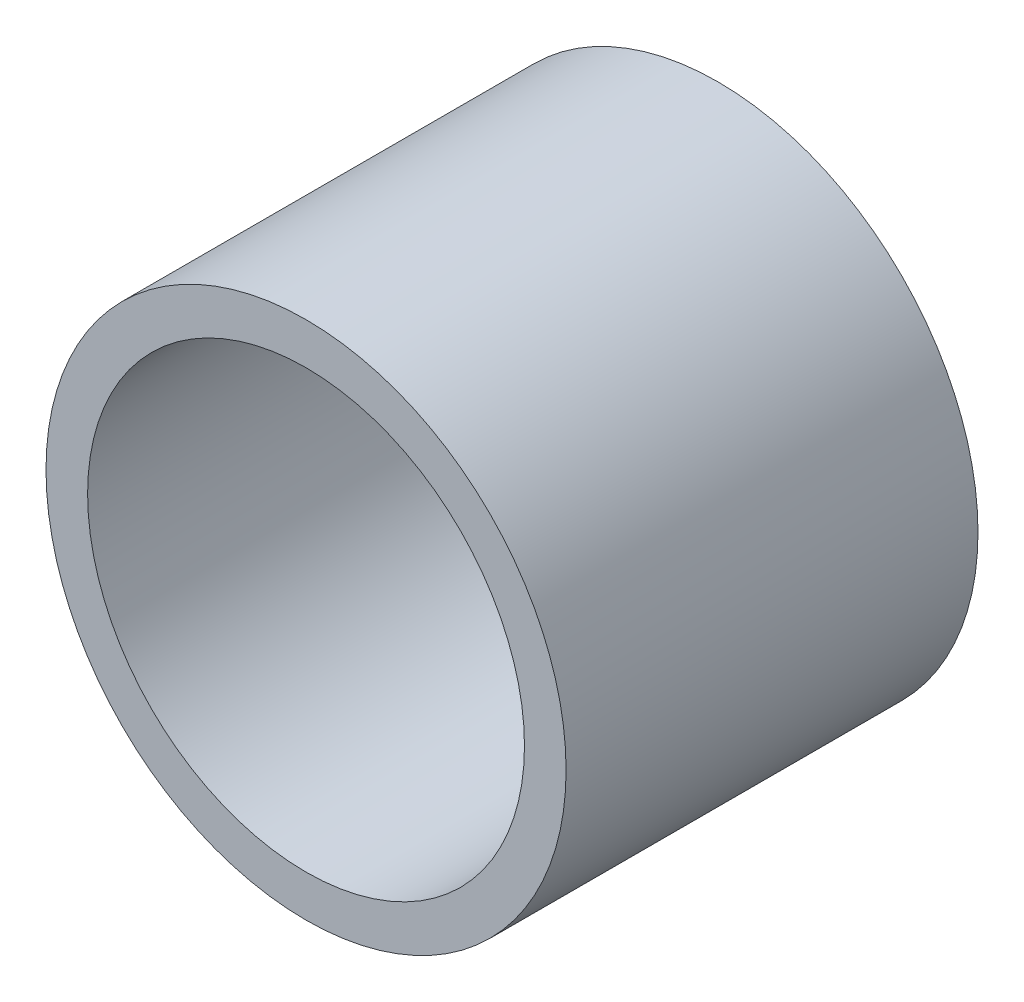
from build123d import *

# Parameters (mm, degrees)
ESBO_O1_R                = 12.5
ESBO_O1_R_2              = 10.5
RESSALTO_EXTRUS_O1_DEPTH = 19.8


with BuildPart() as part:
    # Esboço1 → Ressalto-extrusão1 (new body)
    with BuildSketch(Plane.XY):
        with Locations(Location((0, 0, 0), (0, 0, 180))):
            Circle(ESBO_O1_R)
        with Locations(Location((0, 0, 0), (0, 0, 180))):
            Circle(ESBO_O1_R_2, mode=Mode.SUBTRACT)
    extrude(amount=RESSALTO_EXTRUS_O1_DEPTH)


solid = part.part
